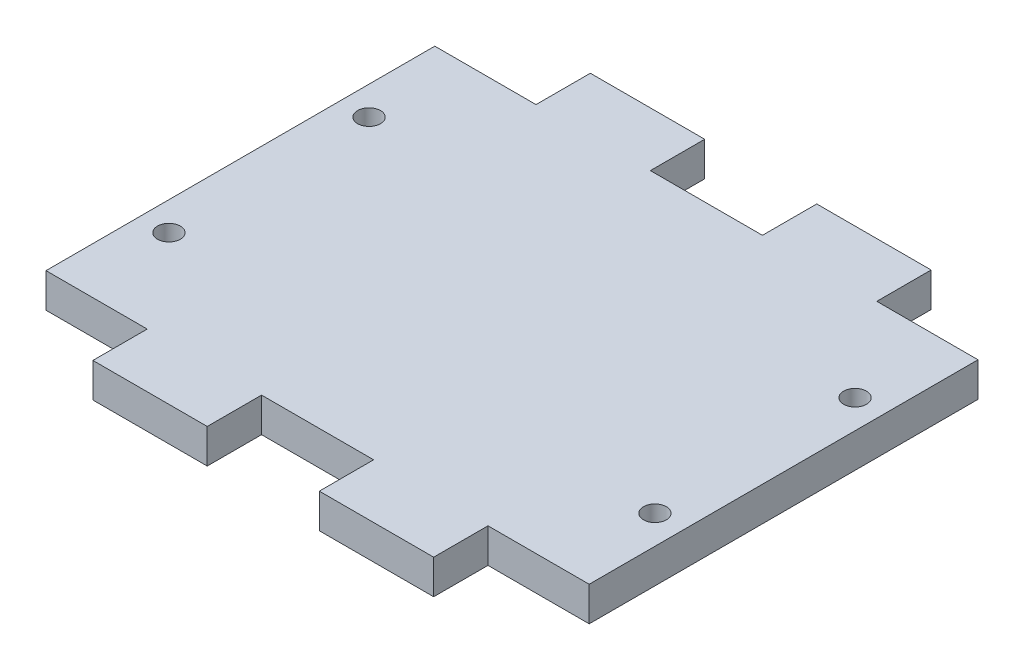
from build123d import *

# Parameters (mm, degrees)
BOSS_EXTRUDE1_DEPTH = 3
SKETCH2_R           = 1
CUT_EXTRUDE1_DEPTH  = 10


with BuildPart() as part:
    # Sketch1 → Boss-Extrude1 (new body)
    with BuildSketch(Plane(origin=(0, 0, 0), x_dir=(1, 0, 0), z_dir=(0, 1, 0))):
        Polygon((4.9, 17), (4.9, 21.75), (14.9, 21.75), (14.9, 17), (23.75, 17), (23.75, -17), (14.9, -17), (14.9, -21.75), (4.9, -21.75), (4.9, -17), (-4.9, -17), (-4.9, -21.75), (-14.9, -21.75), (-14.9, -17), (-23.75, -17), (-23.75, 17), (-14.9, 17), (-14.9, 21.75), (-4.9, 21.75), (-4.9, 17), align=None)
    extrude(amount=BOSS_EXTRUDE1_DEPTH)

    # Sketch2 → Cut-Extrude1 (cut)
    with BuildSketch(Plane(origin=(0, 3, 0), x_dir=(1, 0, 0), z_dir=(0, 1, 0))):
        with Locations(Location((-21.25, 8.75, 0), (0, 0, 270))):
            Circle(SKETCH2_R)
        with Locations(Location((-21.25, -8.75, 0), (0, 0, 270))):
            Circle(SKETCH2_R)
        with Locations(Location((21.25, -8.75, 0), (0, 0, 270))):
            Circle(SKETCH2_R)
        with Locations(Location((21.25, 8.75, 0), (0, 0, 270))):
            Circle(SKETCH2_R)
    extrude(amount=-CUT_EXTRUDE1_DEPTH, mode=Mode.SUBTRACT)


solid = part.part
